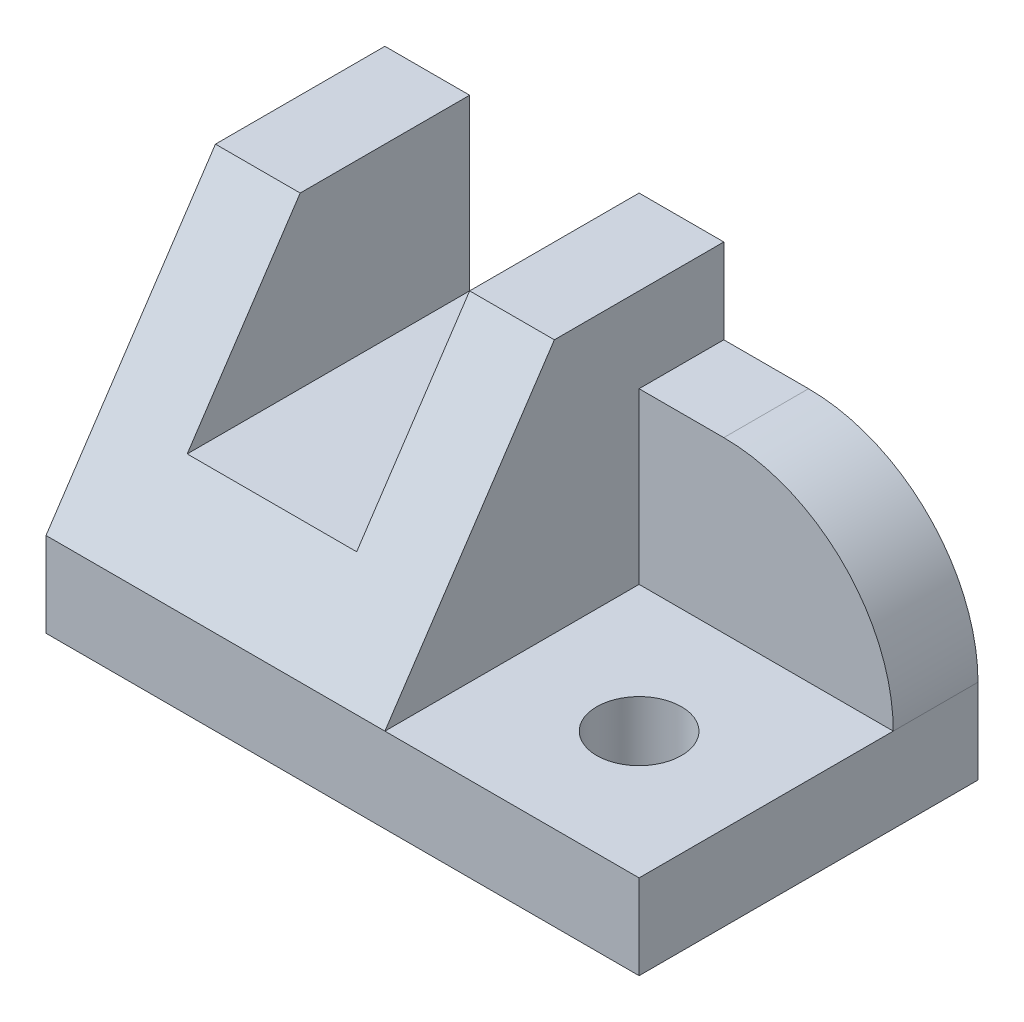
from build123d import *

# Parameters (mm, degrees)
BOSS_EXTRUDE1_DEPTH            = 40
SKETCH2_W                      = 40
SKETCH2_H                      = 30
BOSS_EXTRUDE2_DEPTH            = 20
BOSS_EXTRUDE3_DEPTH            = 30
CUT_EXTRUDE1_DEPTH             = 30
SKETCH5_W                      = 70
SKETCH5_H                      = 40
BOSS_EXTRUDE4_DEPTH            = 10
SKETCH6_W                      = 20
SKETCH6_H                      = 20
CUT_EXTRUDE2_DEPTH             = 91
F_10_0_10_DIAMETER_HOLE1_D     = 10
F_10_0_10_DIAMETER_HOLE1_DEPTH = 40
FILLET1_R                      = 20


with BuildPart() as part:
    # Sketch1 → Boss-Extrude1 (new body)
    with BuildSketch(Plane(origin=(0, 0, 0), x_dir=(0, -1, 0), z_dir=(-1, 0, 0))):
        Polygon((-10, 0), (-40, -20), (-10, -20), align=None)
    extrude(amount=-BOSS_EXTRUDE1_DEPTH)

    # Sketch2 → Boss-Extrude2 (add)
    with BuildSketch(Plane(origin=(0, 0, -20), x_dir=(-1, 0, 0), z_dir=(0, 0, -1))):
        with Locations((-20, 25)):
            Rectangle(SKETCH2_W, SKETCH2_H)
    extrude(amount=BOSS_EXTRUDE2_DEPTH)

    # Sketch3 → Boss-Extrude3 (add)
    with BuildSketch(Plane(origin=(40, 0, 0), x_dir=(0, 0, -1), z_dir=(1, 0, 0))):
        Polygon((40, 10), (0, 10), (20, 40), (40, 40), align=None)
    extrude(amount=BOSS_EXTRUDE3_DEPTH)

    # Sketch4 → Cut-Extrude1 (cut)
    with BuildSketch(Plane(origin=(70, 0, 0), x_dir=(0, 0, -1), z_dir=(1, 0, 0))):
        Polygon((20, 40), (0, 10), (30, 10), (30, 30), (40, 30), (40, 40), align=None)
    extrude(amount=-CUT_EXTRUDE1_DEPTH, mode=Mode.SUBTRACT)

    # Sketch5 → Boss-Extrude4 (add)
    with BuildSketch(Plane.XZ.offset(-10)):
        with Locations((35, -20)):
            Rectangle(SKETCH5_W, SKETCH5_H)
    extrude(amount=BOSS_EXTRUDE4_DEPTH)

    # Sketch6 → Cut-Extrude2 (cut, through all)
    with BuildSketch(Plane(origin=(0, 0, -40), x_dir=(-1, 0, 0), z_dir=(0, 0, -1))):
        with Locations((-20, 30)):
            Rectangle(SKETCH6_W, SKETCH6_H)
    extrude(amount=-CUT_EXTRUDE2_DEPTH, mode=Mode.SUBTRACT)

    # Ø10.0 (10) Diameter Hole1
    with Locations(Plane(origin=(0, 0, 0), x_dir=(-1, 0, 0), z_dir=(0, -1, 0))):
        with Locations((-55, 15)):
            Hole(F_10_0_10_DIAMETER_HOLE1_D / 2, depth=F_10_0_10_DIAMETER_HOLE1_DEPTH)

    # Fillet1
    fillet1_edges = [part.edges().sort_by_distance(p)[0] for p in [
        (70, 30, -35),
    ]]
    fillet(fillet1_edges, radius=FILLET1_R)


solid = part.part
